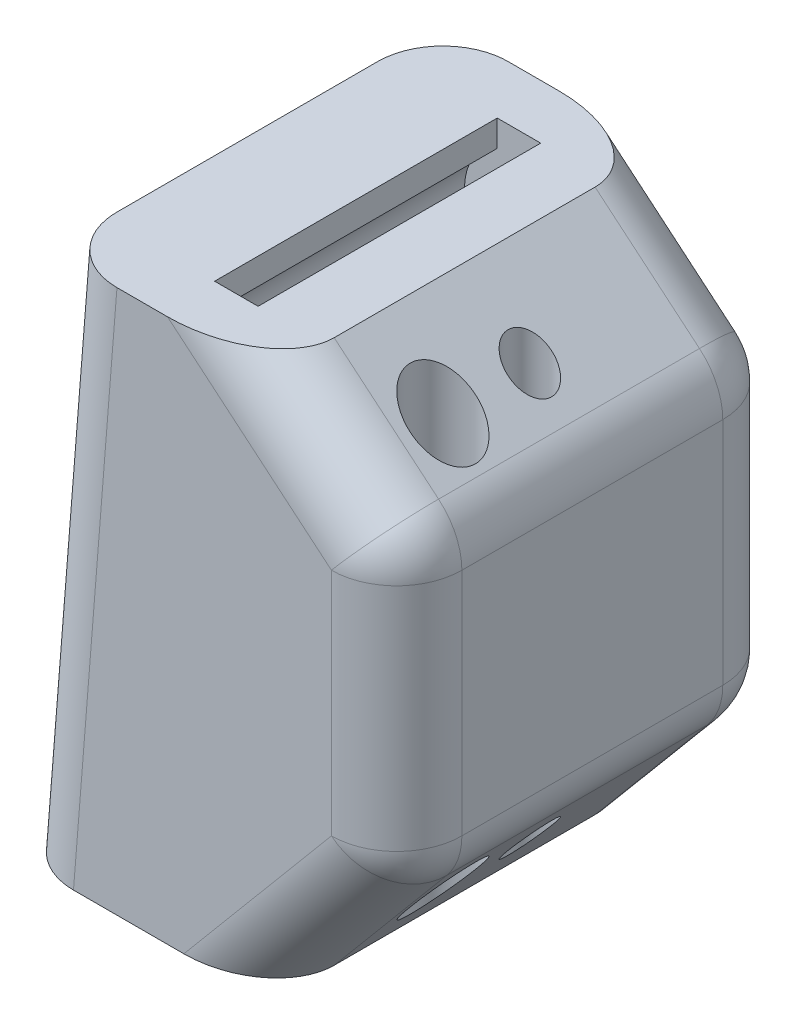
from build123d import *

# Parameters (mm, degrees)
BOSS_EXTRUDE1_DEPTH = 18
CUT_EXTRUDE1_START  = -2.5
CUT_EXTRUDE1_DEPTH  = 13
CUT_EXTRUDE2_START  = -2.5
CUT_EXTRUDE2_DEPTH  = 13
SKETCH5_R           = 1
SKETCH5_R_2         = 1.5
CUT_EXTRUDE3_DEPTH  = 25
FILLET1_R           = 3


with BuildPart() as part:
    # Sketch2 → Boss-Extrude1 (new body)
    with BuildSketch(Plane.XY):
        with BuildLine():
            Line((0, 0), (12, 0))
            Line((12, 0), (17.171830748, 6.163547874))
            ThreePointArc((17.171830748, 6.163547874), (17.692775281, 7.065850273), (17.873697418, 8.091910703))
            Line((17.873697418, 8.091910703), (17.873697418, 18.672459688))
            ThreePointArc((17.873697418, 18.672459688), (17.592620779, 19.940314473), (16.802060247, 20.970593018))
            Line((16.802060247, 20.970593018), (12, 25))
            Line((12, 25), (2, 25))
            Line((2, 25), (0, 0))
        make_face()
    extrude(amount=BOSS_EXTRUDE1_DEPTH)

    # Sketch3 → Cut-Extrude1 (cut)
    with BuildSketch(Plane.XY.offset(18).offset(CUT_EXTRUDE1_START)):
        with BuildLine():
            Line((7, 25), (9, 25))
            Line((9, 25), (9, 23.791287847))
            ThreePointArc((9, 23.791287847), (8, 19), (7, 23.791287847))
            Line((7, 23.791287847), (7, 25))
        make_face()
    extrude(amount=-CUT_EXTRUDE1_DEPTH, mode=Mode.SUBTRACT)

    # Sketch4 → Cut-Extrude2 (cut)
    with BuildSketch(Plane(origin=(0, 0, 0), x_dir=(-1, 0, 0), z_dir=(0, 0, -1)).offset(CUT_EXTRUDE2_START)):
        with BuildLine():
            Line((-9, 0), (-7, 0))
            Line((-7, 0), (-7, 1.208712153))
            ThreePointArc((-7, 1.208712153), (-8, 6), (-9, 1.208712153))
            Line((-9, 1.208712153), (-9, 0))
        make_face()
    extrude(amount=-CUT_EXTRUDE2_DEPTH, mode=Mode.SUBTRACT)

    # Sketch5 → Cut-Extrude3 (cut)
    with BuildSketch(Plane(origin=(0, 0, 0), x_dir=(1, 0, 0), z_dir=(0, 1, 0))):
        with Locations((15, -9)):
            Circle(SKETCH5_R)
        with Locations((15, -13)):
            Circle(SKETCH5_R_2)
    extrude(amount=CUT_EXTRUDE3_DEPTH, mode=Mode.SUBTRACT)

    # Fillet1
    fillet1_edges = [part.edges().sort_by_distance(p)[0] for p in [
        (17.692775281, 7.065850273, 0),
        (14.585915374, 3.081773937, 0),
        (1, 12.5, 0),
        (14.585915374, 3.081773937, 18),
        (17.692775281, 7.065850273, 18),
        (17.873697418, 13.382185196, 18),
        (17.592620779, 19.940314473, 18),
        (14.401030124, 22.985296509, 18),
        (1, 12.5, 18),
        (14.401030124, 22.985296509, 0),
        (17.592620779, 19.940314473, 0),
        (17.873697418, 13.382185196, 0),
    ]]
    fillet(fillet1_edges, radius=FILLET1_R)


solid = part.part
